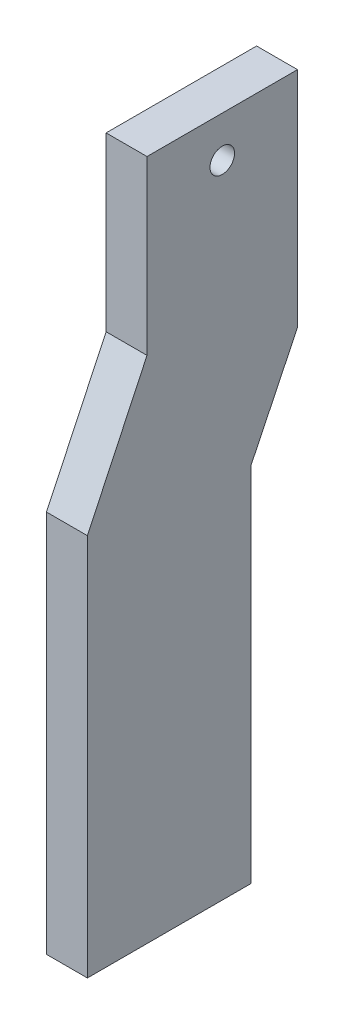
from build123d import *

# Parameters (mm, degrees)
EXTRUDE_1_DEPTH     = 10
SKETCH_2_R          = 3
CUT_EXTRUDE_1_DEPTH = 25


with BuildPart() as part:
    # Эскиз1 → Вытянуть1 (new body)
    with BuildSketch(Plane(origin=(0, 0, 0), x_dir=(0, 0, -1), z_dir=(1, 0, 0))):
        Polygon((-19.99990009, 63.483695787), (-5.430696524, 94.358841013), (-5.430696524, 136.453197444), (31.353949284, 136.453197444), (31.353949284, 81.897126676), (20.00009991, 58.395614664), (20.00009991, -30.143863535), (-19.99990009, -30.143863535), align=None)
    extrude(amount=EXTRUDE_1_DEPTH)

    # Эскиз2 → Вырез-Вытянуть1 (cut)
    with BuildSketch(Plane.ZY):
        with Locations((-12.96162638, 126.453197444)):
            Circle(SKETCH_2_R)
    extrude(amount=-CUT_EXTRUDE_1_DEPTH, mode=Mode.SUBTRACT)


solid = part.part
